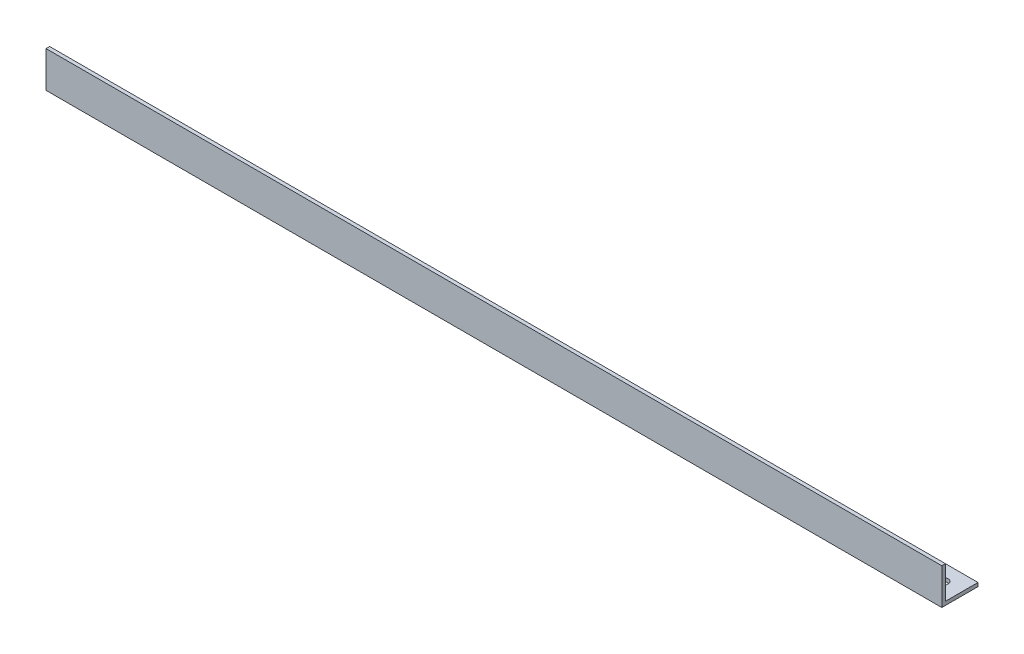
from build123d import *

# Parameters (mm, degrees)
BOSS_EXTRUDE1_DEPTH      = 325
BOSS_EXTRUDE1_DEPTH_BACK = 170
SKETCH2_R                = 2.95
SKETCH2_R_2              = 2.5
CUT_EXTRUDE1_DEPTH       = 2


with BuildPart() as part:
    # Sketch1 → Boss-Extrude1 (new, two sides: drawn at the far end of the back side and taken through both)
    with BuildSketch(Plane(origin=(0, 0, 0), x_dir=(0, 0, -1), z_dir=(1, 0, 0)).offset(-BOSS_EXTRUDE1_DEPTH_BACK)):
        Polygon((0, 20), (0, 0), (20, 0), (20, 2), (2, 2), (2, 20), align=None)
    extrude(amount=BOSS_EXTRUDE1_DEPTH + BOSS_EXTRUDE1_DEPTH_BACK)

    # Sketch2 → Cut-Extrude1 (cut)
    with BuildSketch(Plane(origin=(0, 2, 0), x_dir=(1, 0, 0), z_dir=(0, 1, 0))):
        with Locations(Location((0, 9.8, 0), (0, 0, 270))):
            Circle(SKETCH2_R)
        with Locations(Location((315, 11, 0), (0, 0, 270))):
            Circle(SKETCH2_R_2)
        with Locations(Location((-160, 11, 0), (0, 0, 270))):
            Circle(SKETCH2_R_2)
    extrude(amount=-CUT_EXTRUDE1_DEPTH, mode=Mode.SUBTRACT)


solid = part.part
